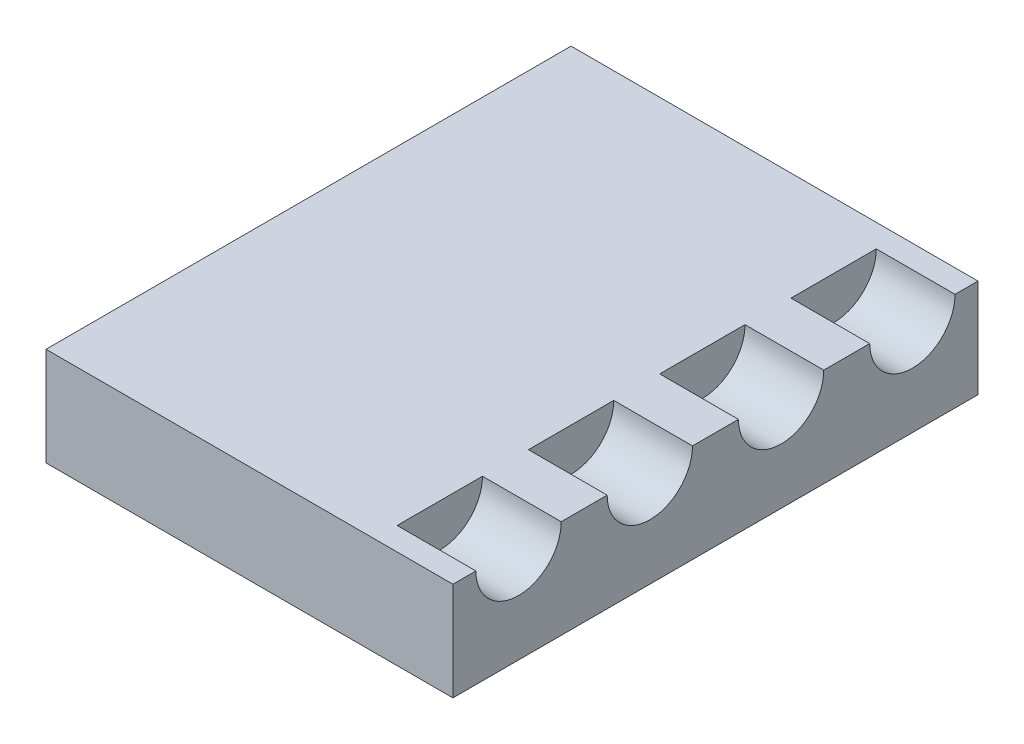
from build123d import *

# Parameters (mm, degrees)
BOSS_EXTRUDE1_DEPTH = 12
SKETCH2_W           = 80
SKETCH2_H           = 15
BOSS_EXTRUDE2_DEPTH = 50


with BuildPart() as part:
    # Sketch1 → Boss-Extrude1 (new body)
    with BuildSketch(Plane(origin=(0, 0, 0), x_dir=(0, 0, -1), z_dir=(1, 0, 0))):
        with BuildLine():
            Line((40, 0), (36.5, 0))
            ThreePointArc((36.5, 0), (30, -6.5), (23.5, 0))
            Line((23.5, 0), (16.5, 0))
            ThreePointArc((16.5, 0), (10, -6.5), (3.5, 0))
            Line((3.5, 0), (-3.5, 0))
            ThreePointArc((-3.5, 0), (-10, -6.5), (-16.5, 0))
            Line((-16.5, 0), (-23.5, 0))
            ThreePointArc((-23.5, 0), (-30, -6.5), (-36.5, 0))
            Line((-36.5, 0), (-40, 0))
            Line((-40, 0), (-40, -15))
            Line((-40, -15), (40, -15))
            Line((40, -15), (40, 0))
        make_face()
    extrude(amount=BOSS_EXTRUDE1_DEPTH)

    # Sketch2 → Boss-Extrude2 (add)
    with BuildSketch(Plane.ZY):
        with Locations((0, -7.5)):
            Rectangle(SKETCH2_W, SKETCH2_H)
    extrude(amount=BOSS_EXTRUDE2_DEPTH)


solid = part.part
